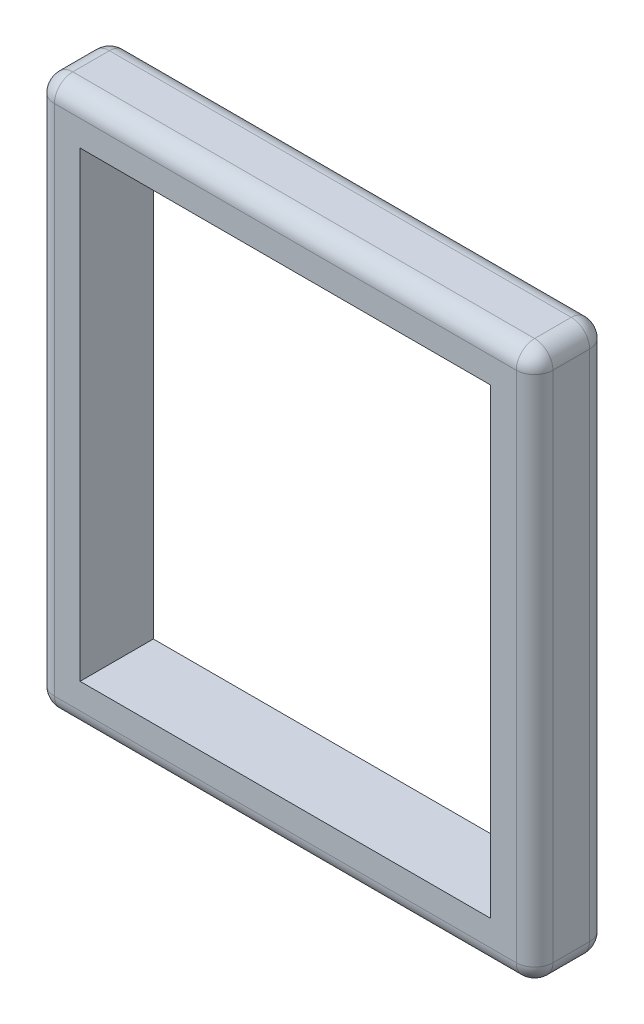
from build123d import *

# Parameters (mm, degrees)
SKETCH1_W           = 86.36
SKETCH1_H           = 95.25
SKETCH1_W_2         = 71.12
SKETCH1_H_2         = 80.01
BOSS_EXTRUDE1_DEPTH = 12.7
FILLET1_R           = 3.175


with BuildPart() as part:
    # Sketch1 → Boss-Extrude1 (new body)
    with BuildSketch(Plane.XY):
        with Locations((-43.18, 47.625)):
            Rectangle(SKETCH1_W, SKETCH1_H)
        with Locations((-43.18, 47.625)):
            Rectangle(SKETCH1_W_2, SKETCH1_H_2, mode=Mode.SUBTRACT)
    extrude(amount=BOSS_EXTRUDE1_DEPTH)

    # Fillet1
    fillet1_edges = [part.edges().sort_by_distance(p)[0] for p in [
        (-86.36, 47.625, 12.7),
        (-43.18, 0, 12.7),
        (0, 47.625, 12.7),
        (-43.18, 0, 0),
        (-86.36, 47.625, 0),
        (-43.18, 95.25, 0),
        (0, 47.625, 0),
        (0, 0, 6.35),
        (-86.36, 0, 6.35),
        (-86.36, 95.25, 6.35),
        (0, 95.25, 6.35),
        (-43.18, 95.25, 12.7),
    ]]
    fillet(fillet1_edges, radius=FILLET1_R)


solid = part.part
